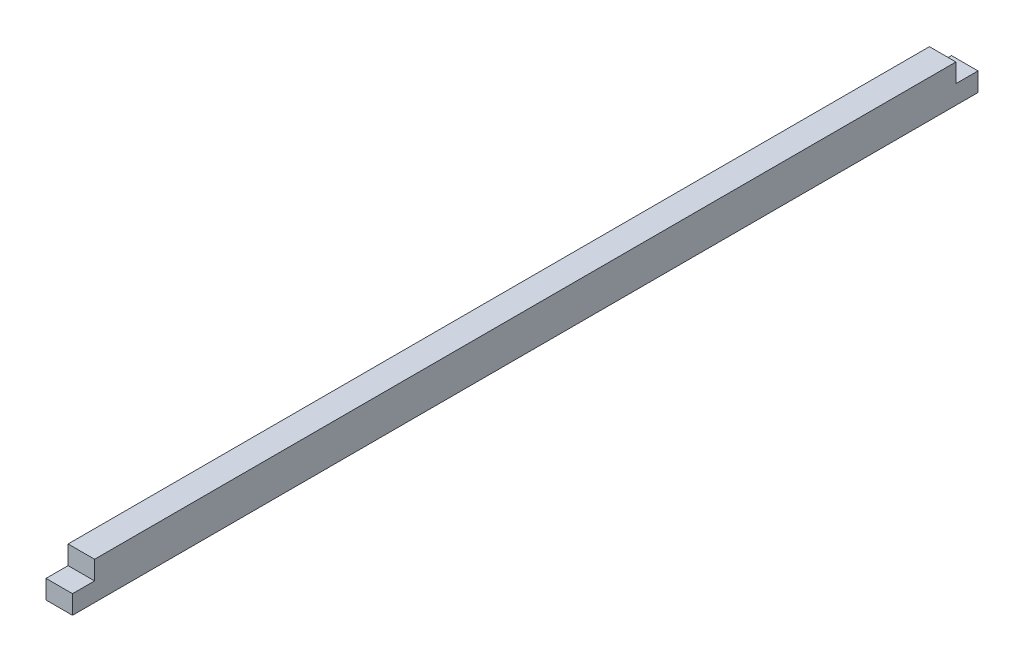
from build123d import *

# Parameters (mm, degrees)
SKETCH1_W           = 410
SKETCH1_H           = 17
BOSS_EXTRUDE1_DEPTH = 12
SKETCH2_W           = 10
SKETCH2_H           = 8.5
CUT_EXTRUDE1_DEPTH  = 12


with BuildPart() as part:
    # Sketch1 → Boss-Extrude1 (new body)
    with BuildSketch(Plane(origin=(0, 0, 0), x_dir=(0, 0, -1), z_dir=(1, 0, 0))):
        with Locations((205, 8.5)):
            Rectangle(SKETCH1_W, SKETCH1_H)
    extrude(amount=BOSS_EXTRUDE1_DEPTH)

    # Sketch2 → Cut-Extrude1 (cut)
    with BuildSketch(Plane(origin=(12, 0, 0), x_dir=(0, 0, -1), z_dir=(1, 0, 0))):
        with Locations((5, 12.75)):
            Rectangle(SKETCH2_W, SKETCH2_H)
        with Locations((405, 12.75)):
            Rectangle(SKETCH2_W, SKETCH2_H)
    extrude(amount=-CUT_EXTRUDE1_DEPTH, mode=Mode.SUBTRACT)


solid = part.part
